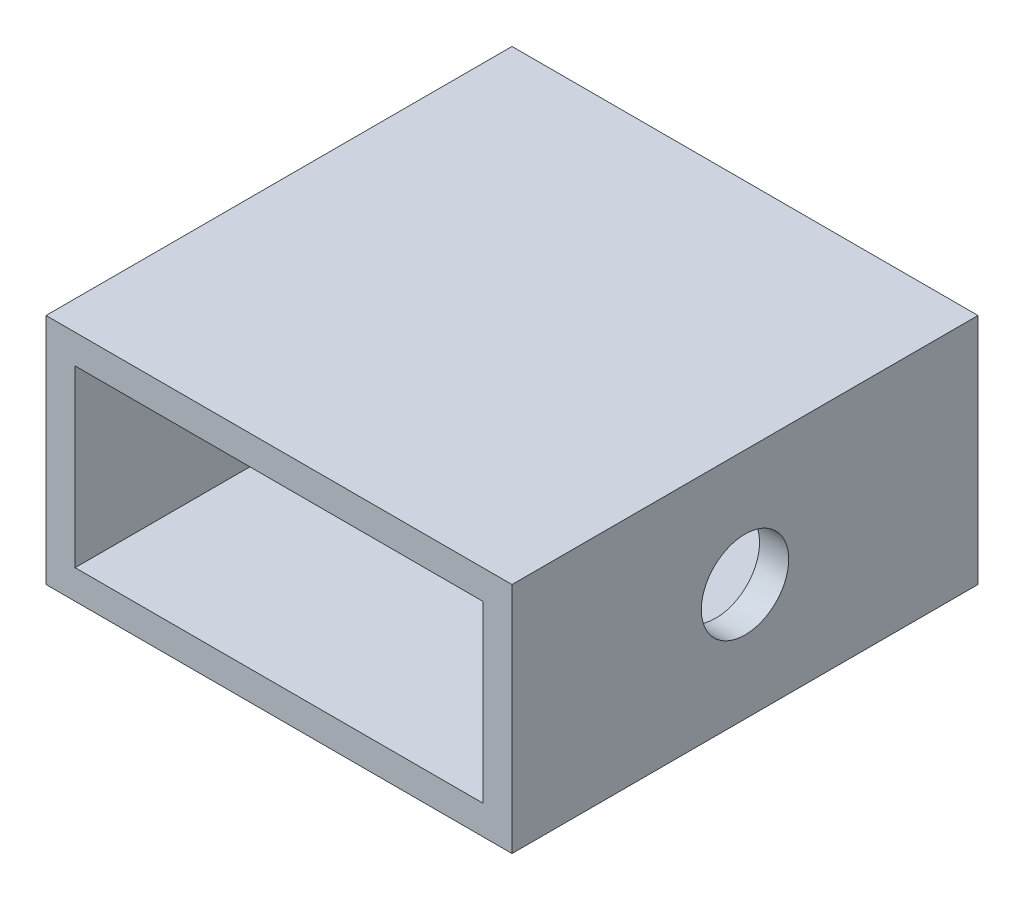
from build123d import *

# Parameters (mm, degrees)
SKETCH1_W           = 50.8
SKETCH1_H           = 25.4
SKETCH1_W_2         = 44.45
SKETCH1_H_2         = 19.05
BOSS_EXTRUDE1_DEPTH = 50.8
SKETCH2_R           = 4.7625
CUT_EXTRUDE1_DEPTH  = 73.955945611


with BuildPart() as part:
    # Sketch1 → Boss-Extrude1 (new body)
    with BuildSketch(Plane.XY):
        Rectangle(SKETCH1_W, SKETCH1_H)
        Rectangle(SKETCH1_W_2, SKETCH1_H_2, mode=Mode.SUBTRACT)
    extrude(amount=BOSS_EXTRUDE1_DEPTH)

    # Sketch2 → Cut-Extrude1 (cut, through all)
    with BuildSketch(Plane.ZY.offset(25.4)):
        with Locations((25.4, 0)):
            Circle(SKETCH2_R)
    extrude(amount=-CUT_EXTRUDE1_DEPTH, mode=Mode.SUBTRACT)


solid = part.part
